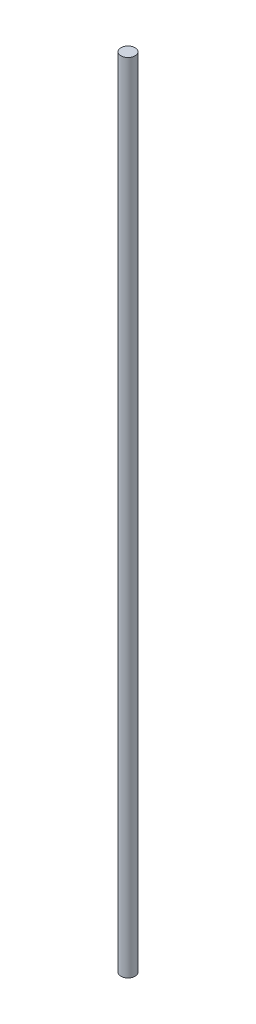
from build123d import *

# Parameters (mm, degrees)
SKETCH1_R           = 6
BOSS_EXTRUDE1_DEPTH = 680


with BuildPart() as part:
    # Sketch1 → Boss-Extrude1 (new body)
    with BuildSketch(Plane(origin=(0, 0, 0), x_dir=(1, 0, 0), z_dir=(0, 1, 0))):
        with Locations(Location((0, 0, 0), (0, 0, 270))):
            Circle(SKETCH1_R)
    extrude(amount=BOSS_EXTRUDE1_DEPTH)


solid = part.part
